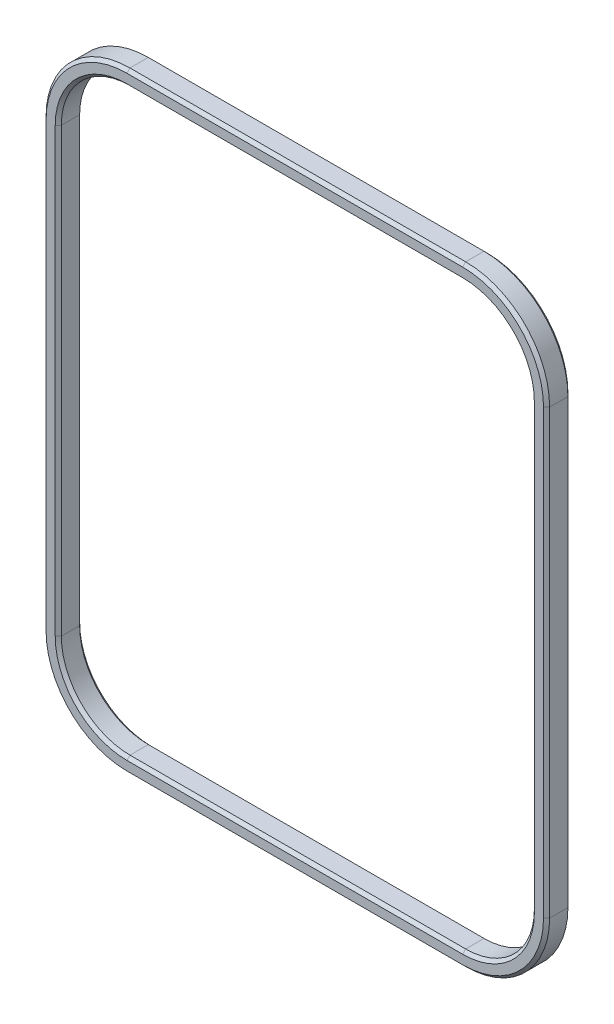
from build123d import *

# Parameters (mm, degrees)
AUFSATZ_LINEAR_AUSTRAGEN1_DEPTH = 1.6
FASE1_SIZE                      = 0.2


with BuildPart() as part:
    # Skizze1 → Aufsatz-Linear austragen1 (new body)
    with BuildSketch(Plane(origin=(0, 0, 0), x_dir=(0, 1, 0), z_dir=(0, 0, 1))):
        with BuildLine():
            Line((-20, -11), (-20, 11))
            ThreePointArc((-20, 11), (-18.389087297, 14.889087297), (-14.5, 16.5))
            Line((-14.5, 16.5), (14.5, 16.5))
            ThreePointArc((14.5, 16.5), (18.389087297, 14.889087297), (20, 11))
            Line((20, 11), (20, -11))
            ThreePointArc((20, -11), (18.389087297, -14.889087297), (14.5, -16.5))
            Line((14.5, -16.5), (-14.5, -16.5))
            ThreePointArc((-14.5, -16.5), (-18.389087297, -14.889087297), (-20, -11))
        make_face()
        with BuildLine():
            Line((-14.5, -15.5), (14.5, -15.5))
            ThreePointArc((14.5, -15.5), (17.681980515, -14.181980515), (19, -11))
            Line((19, -11), (19, 11))
            ThreePointArc((19, 11), (17.681980515, 14.181980515), (14.5, 15.5))
            Line((14.5, 15.5), (-14.5, 15.5))
            ThreePointArc((-14.5, 15.5), (-17.681980515, 14.181980515), (-19, 11))
            Line((-19, 11), (-19, -11))
            ThreePointArc((-19, -11), (-17.681980515, -14.181980515), (-14.5, -15.5))
        make_face(mode=Mode.SUBTRACT)
    extrude(amount=AUFSATZ_LINEAR_AUSTRAGEN1_DEPTH)

    # Fase1
    fase1_edges = [part.edges().sort_by_distance(p)[0] for p in [
        (16.5, 0, 0),
        (14.889087297, -18.389087297, 0),
        (0, -20, 0),
        (-14.889087297, -18.389087297, 0),
        (14.889087297, -18.389087297, 1.6),
        (16.5, 0, 1.6),
        (14.889087297, 18.389087297, 1.6),
        (0, 20, 1.6),
        (14.181980515, 17.681980515, 0),
        (0, 19, 0),
        (-14.181980515, 17.681980515, 0),
        (-15.5, 0, 0),
        (-14.889087297, 18.389087297, 1.6),
        (-14.181980515, -17.681980515, 0),
        (0, -19, 0),
        (14.181980515, -17.681980515, 0),
        (15.5, 0, 0),
        (14.181980515, 17.681980515, 1.6),
        (0, 19, 1.6),
        (-14.181980515, 17.681980515, 1.6),
        (-15.5, 0, 1.6),
        (-14.181980515, -17.681980515, 1.6),
        (0, -19, 1.6),
        (14.181980515, -17.681980515, 1.6),
        (-16.5, 0, 1.6),
        (15.5, 0, 1.6),
        (-14.889087297, -18.389087297, 1.6),
        (-16.5, 0, 0),
        (0, -20, 1.6),
        (-14.889087297, 18.389087297, 0),
        (0, 20, 0),
        (14.889087297, 18.389087297, 0),
    ]]
    chamfer(fase1_edges, length=FASE1_SIZE)


solid = part.part
